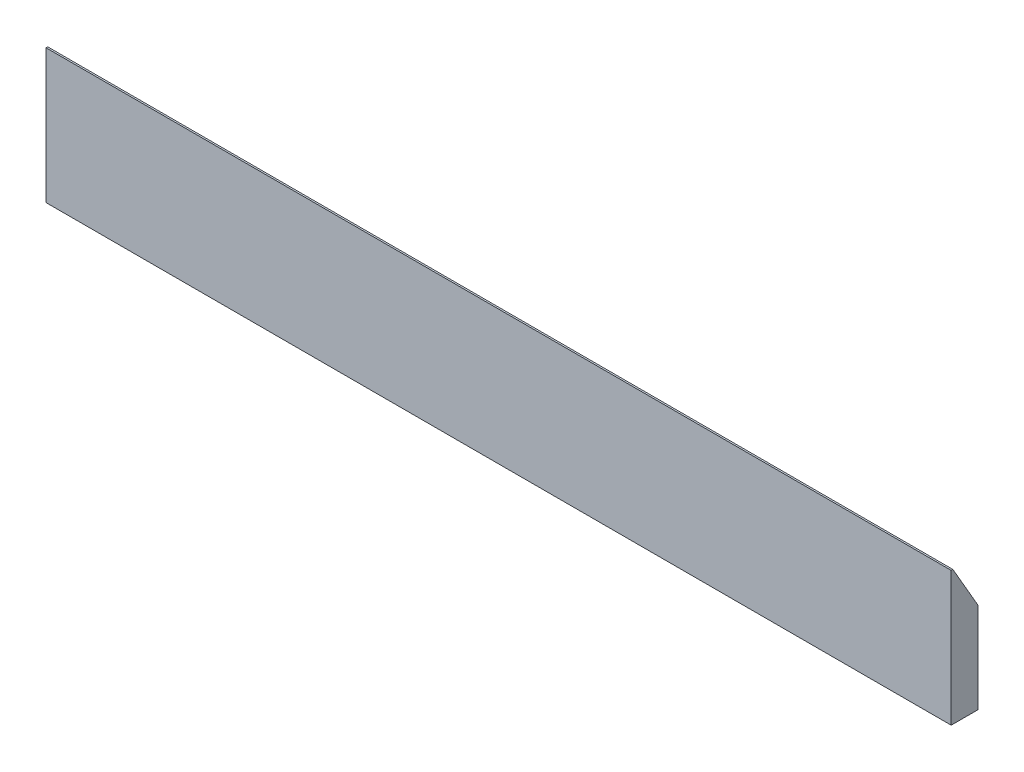
from build123d import *

# Parameters (mm, degrees)
SKETCH_1_W      = 54
SKETCH_1_H      = 8
EXTRUDE_1_DEPTH = 0.4
SKETCH_2_W      = 3
SKETCH_2_H      = 8
EXTRUDE_2_DEPTH = 1.2
SKETCH_3_W      = 54
SKETCH_3_H      = 1.6
EXTRUDE_3_DEPTH = 2
CHAMFER_1_SIZE  = 1.5
CHAMFER_1_SIZE2 = 2.598076211


with BuildPart() as part:
    # 草图1 → 凸台-拉伸1 (new body)
    with BuildSketch(Plane.XY):
        Rectangle(SKETCH_1_W, SKETCH_1_H)
    extrude(amount=EXTRUDE_1_DEPTH)

    # 草图2 → 凸台-拉伸2 (add)
    with BuildSketch(Plane(origin=(0, 0, 0), x_dir=(-1, 0, 0), z_dir=(0, 0, -1))):
        with Locations((-25.5, 0)):
            Rectangle(SKETCH_2_W, SKETCH_2_H)
    extrude(amount=EXTRUDE_2_DEPTH)

    # 草图3 → 凸台-拉伸3 (add)
    with BuildSketch(Plane.XZ.offset(4)):
        with Locations((0, -0.4)):
            Rectangle(SKETCH_3_W, SKETCH_3_H)
    extrude(amount=-EXTRUDE_3_DEPTH)

    # 倒角1
    chamfer_1_edges = [part.edges().sort_by_distance(p)[0] for p in [
        (25.5, 4, -1.2),
    ]]
    chamfer_1_side = [part.faces().sort_by_distance(p)[0] for p in [
        (3.642857143, 4, 0.085714286),
    ]]
    chamfer(chamfer_1_edges, length=CHAMFER_1_SIZE, length2=CHAMFER_1_SIZE2, reference=chamfer_1_side[0])


solid = part.part
